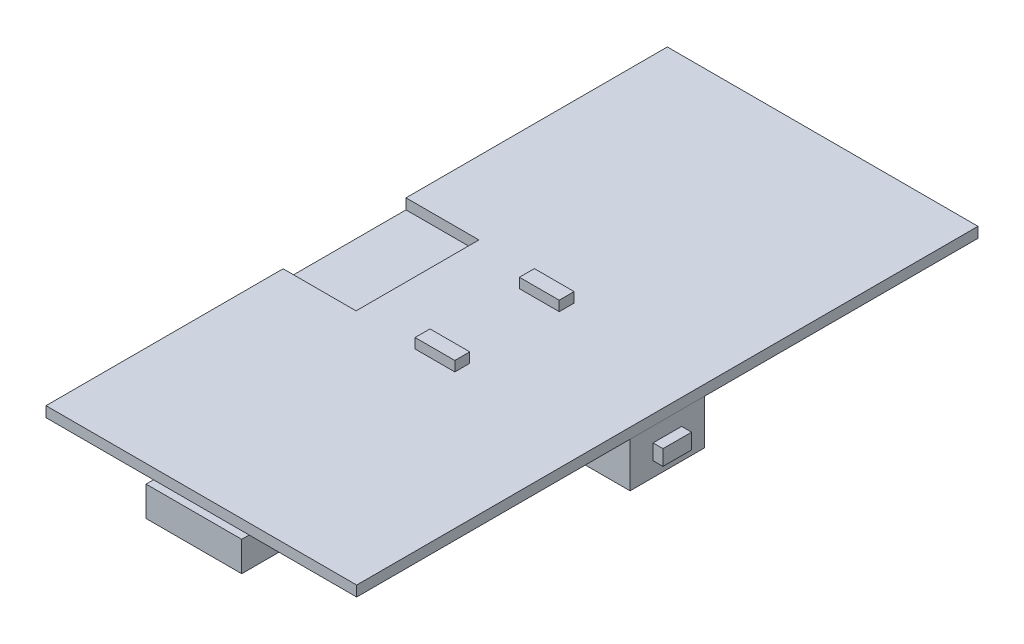
from build123d import *

# Parameters (mm, degrees)
SKETCH1_W             = 31.75
SKETCH1_H             = 63.5
BAREBOARD_DEPTH       = 1.0668
SKETCH2_W             = 9.779
SKETCH2_H             = 6.35
USB_DEPTH             = 3.048
SKETCH3_W             = 4.064
SKETCH3_H             = 1.524
SIDEFIRE_LEDS_DEPTH   = 1.016
SIDEFIRE_LEDS_2_DEPTH = 1.016
SKETCH4_W             = 20.32
SKETCH4_H             = 12.7
BLE_RADIO_DEPTH       = 2.794
SKETCH5_W             = 6.35
SKETCH5_H             = 12.7
CUT_BLE1_DEPTH        = 2.032
SKETCH6_W             = 12.7
SKETCH6_H             = 12.556872392
CUT_BLE2_DEPTH        = 1.0668
SKETCH7_W             = 6.35
SKETCH7_H             = 7.62
SWITCHBASE_DEPTH      = 4.572
SKETCH8_W             = 2.921
SKETCH8_H             = 1.5748
BUTTONSWITCH_DEPTH    = 1.016


with BuildPart() as part:
    # Sketch1 → BareBoard (new body)
    with BuildSketch(Plane(origin=(0, 0, 0), x_dir=(1, 0, 0), z_dir=(0, 1, 0))):
        Rectangle(SKETCH1_W, SKETCH1_H)
    extrude(amount=BAREBOARD_DEPTH)

    # Sketch6 → Cut-BLE2 (cut)
    with BuildSketch(Plane(origin=(0, 1.0668, 0), x_dir=(1, 0, 0), z_dir=(0, 1, 0))):
        with Locations((-14.770961261, -1.238442872)):
            Rectangle(SKETCH6_W, SKETCH6_H)
    extrude(amount=-CUT_BLE2_DEPTH, mode=Mode.SUBTRACT)


with BuildPart() as body_2:
    # Sketch2 → USB (new body)
    with BuildSketch(Plane.XZ):
        with Locations((0, 29.337)):
            Rectangle(SKETCH2_W, SKETCH2_H)
    extrude(amount=USB_DEPTH)


with BuildPart() as body_3:
    # Sketch3 → SideFire LEDs (new body)
    with BuildSketch(Plane(origin=(0, 1.0668, 0), x_dir=(1, 0, 0), z_dir=(0, 1, 0))):
        with Locations((0, 3.556)):
            Rectangle(SKETCH3_W, SKETCH3_H)
    extrude(amount=SIDEFIRE_LEDS_DEPTH)


with BuildPart() as body_4:
    # Sketch3 → SideFire LEDs 2 (new body)
    with BuildSketch(Plane(origin=(0, 1.0668, 0), x_dir=(1, 0, 0), z_dir=(0, 1, 0))):
        with Locations((0, -7.112)):
            Rectangle(SKETCH3_W, SKETCH3_H)
    extrude(amount=SIDEFIRE_LEDS_2_DEPTH)


with BuildPart() as body_5:
    # Sketch4 → BLE Radio (new body)
    with BuildSketch(Plane.XZ):
        with Locations((-5.715, 1.166879068)):
            Rectangle(SKETCH4_W, SKETCH4_H)
    extrude(amount=BLE_RADIO_DEPTH)

    # Sketch5 → Cut-BLE1 (cut)
    with BuildSketch(Plane.XZ.offset(2.794)):
        with Locations((-12.7, 1.166879068)):
            Rectangle(SKETCH5_W, SKETCH5_H)
    extrude(amount=-CUT_BLE1_DEPTH, mode=Mode.SUBTRACT)


with BuildPart() as body_6:
    # Sketch7 → SwitchBase (new body)
    with BuildSketch(Plane.XZ):
        with Locations((12.7, 0)):
            Rectangle(SKETCH7_W, SKETCH7_H)
    extrude(amount=SWITCHBASE_DEPTH)

    # Sketch8 → ButtonSwitch (add)
    with BuildSketch(Plane(origin=(15.875, 0, 0), x_dir=(0, 0, -1), z_dir=(1, 0, 0))):
        with Locations((0, -2.286)):
            Rectangle(SKETCH8_W, SKETCH8_H)
    extrude(amount=BUTTONSWITCH_DEPTH)


solid = Compound([part.part, body_2.part, body_3.part, body_4.part, body_5.part, body_6.part])
